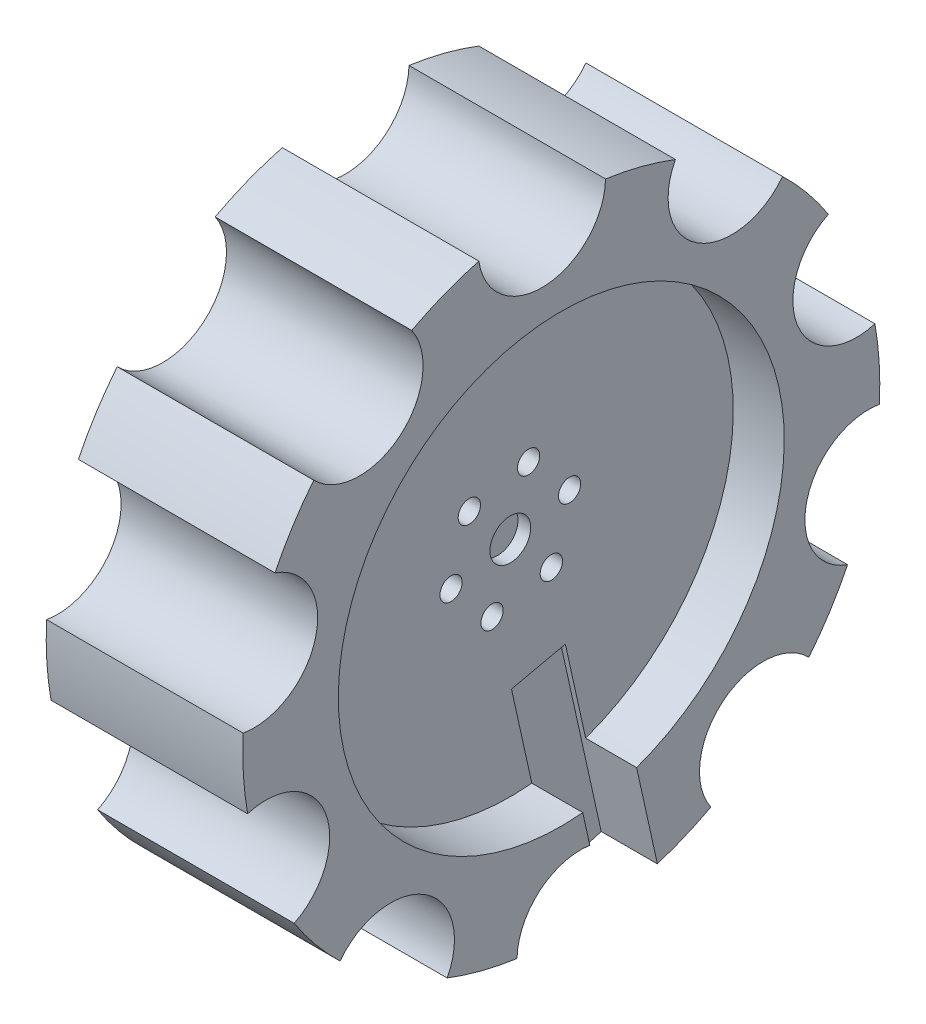
from build123d import *

# Parameters (mm, degrees)
SKETCH1_R           = 50
BOSS_EXTRUDE1_DEPTH = 30.86
SKETCH2_R           = 35
CUT_EXTRUDE1_DEPTH  = 8
CUT_EXTRUDE4_START  = -20
SKETCH10_W          = 10.01875972
SKETCH10_H          = 8.661840267
CUT_EXTRUDE4_DEPTH  = 60
SKETCH12_R          = 3.2
CUT_EXTRUDE5_DEPTH  = 2
SKETCH5_R           = 1.75
CUT_EXTRUDE3_DEPTH  = 30
SKETCH8_R           = 4
CUT_EXTRUDE6_DEPTH  = 10
SKETCH13_R          = 10
CUT_EXTRUDE8_DEPTH  = 40


with BuildPart() as part:
    # Sketch1 → Boss-Extrude1 (new body)
    with BuildSketch(Plane(origin=(0, 0, 0), x_dir=(0, 0, -1), z_dir=(1, 0, 0))):
        Circle(SKETCH1_R)
    extrude(amount=BOSS_EXTRUDE1_DEPTH)

    # Sketch2 → Cut-Extrude1 (cut)
    with BuildSketch(Plane(origin=(30.86, 0, 0), x_dir=(0, 0, -1), z_dir=(1, 0, 0))):
        Circle(SKETCH2_R)
    extrude(amount=-CUT_EXTRUDE1_DEPTH, mode=Mode.SUBTRACT)

    # Sketch10 → Cut-Extrude4 (cut)
    with BuildSketch(Plane(origin=(0, 0, 0), x_dir=(1, 0, 0), z_dir=(0, 0.9763565991877232, 0.2161661195066977)).offset(CUT_EXTRUDE4_START)):
        with Locations((27.048757514, 0.091052199)):
            Rectangle(SKETCH10_W, SKETCH10_H)
    extrude(amount=-CUT_EXTRUDE4_DEPTH, mode=Mode.SUBTRACT)

    # Sketch12 → Cut-Extrude5 (cut)
    with BuildSketch(Plane(origin=(22.86, 0, 0), x_dir=(0, 0, -1), z_dir=(1, 0, 0))):
        Circle(SKETCH12_R)
    extrude(amount=-CUT_EXTRUDE5_DEPTH, mode=Mode.SUBTRACT)

    # Sketch5 → Cut-Extrude3 (cut)
    with BuildSketch(Plane.ZY):
        with Locations((2.868272201, -9.088119419)):
            Circle(SKETCH5_R)
        with Locations((-6.436406189, -7.028056301)):
            Circle(SKETCH5_R)
        with Locations((-9.30467839, 2.060063119)):
            Circle(SKETCH5_R)
        with Locations((-2.868272201, 9.088119419)):
            Circle(SKETCH5_R)
        with Locations((6.436406189, 7.028056301)):
            Circle(SKETCH5_R)
        with Locations((9.30467839, -2.060063119)):
            Circle(SKETCH5_R)
    extrude(amount=-CUT_EXTRUDE3_DEPTH, mode=Mode.SUBTRACT)

    # Sketch8 → Cut-Extrude6 (cut)
    with BuildSketch(Plane.ZY):
        with Locations((-2.868272201, 9.088119419)):
            Circle(SKETCH8_R)
        with Locations((6.436406189, 7.028056301)):
            Circle(SKETCH8_R)
        with Locations((9.30467839, -2.060063119)):
            Circle(SKETCH8_R)
        with Locations((2.868272201, -9.088119419)):
            Circle(SKETCH8_R)
        with Locations((-6.436406189, -7.028056301)):
            Circle(SKETCH8_R)
        with Locations((-9.30467839, 2.060063119)):
            Circle(SKETCH8_R)
    extrude(amount=-CUT_EXTRUDE6_DEPTH, mode=Mode.SUBTRACT)

    # Sketch13 → Cut-Extrude8 (cut)
    with BuildSketch(Plane.ZY):
        with Locations((48.2405892, 12.470792391)):
            Circle(SKETCH13_R)
        with Locations((46.357604333, -18.266023916)):
            Circle(SKETCH13_R)
        with Locations((26.767590248, -42.025839926)):
            Circle(SKETCH13_R)
        with Locations((-3.046733515, -49.733213491)):
            Circle(SKETCH13_R)
        with Locations((-31.69730863, -38.444189871)):
            Circle(SKETCH13_R)
        with Locations((-48.2405892, -12.470792391)):
            Circle(SKETCH13_R)
        with Locations((-46.357604333, 18.266023916)):
            Circle(SKETCH13_R)
        with Locations((-26.767590248, 42.025839926)):
            Circle(SKETCH13_R)
        with Locations((3.046733515, 49.733213491)):
            Circle(SKETCH13_R)
        with Locations((31.69730863, 38.444189871)):
            Circle(SKETCH13_R)
    extrude(amount=-CUT_EXTRUDE8_DEPTH, mode=Mode.SUBTRACT)


solid = part.part
